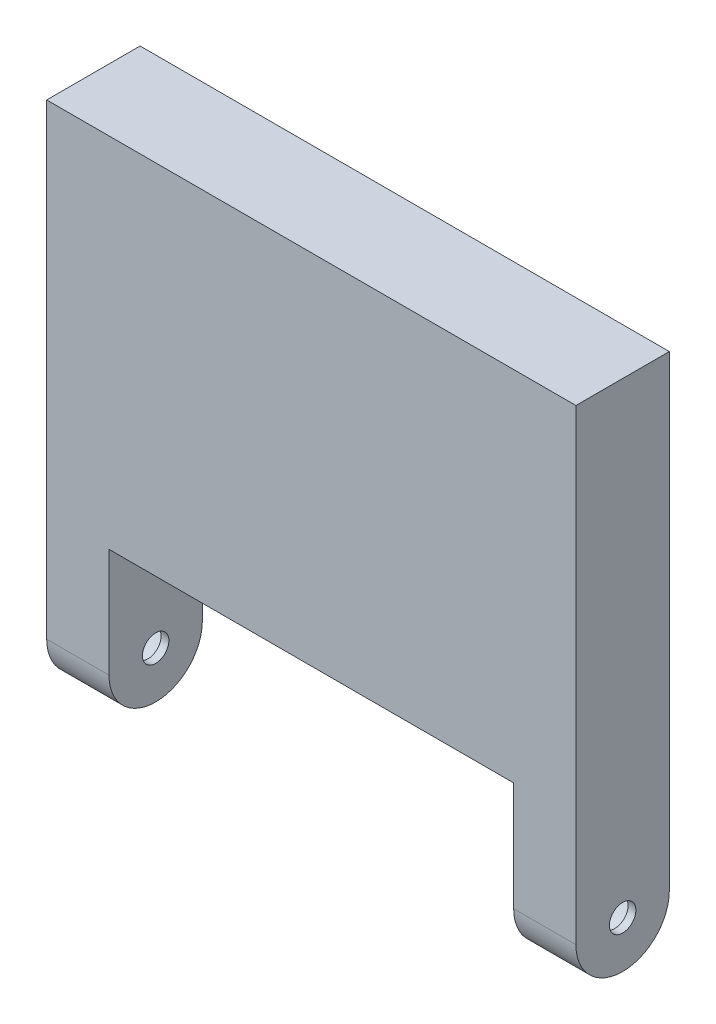
from build123d import *

# Parameters (mm, degrees)
BOSS_EXTRUDE1_START = -170
BOSS_EXTRUDE1_DEPTH = 5
BOSS_EXTRUDE2_START = -165
SKETCH3_4_W         = 5
SKETCH3_4_H         = 5
BOSS_EXTRUDE2_DEPTH = 30
BOSS_EXTRUDE3_START = -135
SKETCH3_5_W         = 50
SKETCH3_5_H         = 220
BOSS_EXTRUDE3_DEPTH = 5
BOSS_EXTRUDE4_START = -130
SKETCH3_6_W         = 5
SKETCH3_6_H         = 5
SKETCH3_6_W_2       = 50
BOSS_EXTRUDE4_DEPTH = 130
SKETCH6_R           = 8.5
CUT_EXTRUDE1_DEPTH  = 347.121365998


with BuildPart() as part:
    # Sketch3 → Boss-Extrude1 (new body)
    with BuildSketch(Plane(origin=(0, 0, 0), x_dir=(0, 0, -1), z_dir=(1, 0, 0)).offset(BOSS_EXTRUDE1_START)):
        with BuildLine():
            Line((-30, 0), (-30, 300))
            Line((-30, 300), (30, 300))
            Line((30, 300), (30, 0))
            ThreePointArc((30, 0), (0, -30), (-30, 0))
        make_face()
    extrude(amount=BOSS_EXTRUDE1_DEPTH)

    # Sketch3<4> → Boss-Extrude2 (add)
    with BuildSketch(Plane(origin=(0, 0, 0), x_dir=(0, 0, -1), z_dir=(1, 0, 0)).offset(BOSS_EXTRUDE2_START)):
        Polygon((-30, 75), (-25, 75), (-25, 295), (25, 295), (25, 75), (30, 75), (30, 300), (-30, 300), align=None)
        with Locations((-27.5, 72.5)):
            Rectangle(SKETCH3_4_W, SKETCH3_4_H)
        with BuildLine():
            Line((0, -30), (0, -25))
            ThreePointArc((0, -25), (-17.67766953, -17.67766953), (-25, 0))
            Line((-25, 0), (-25, 70))
            Line((-25, 70), (-30, 70))
            Line((-30, 70), (-30, 0))
            ThreePointArc((-30, 0), (-21.213203436, -21.213203436), (0, -30))
        make_face()
        with Locations((27.5, 72.5)):
            Rectangle(SKETCH3_4_W, SKETCH3_4_H)
        with BuildLine():
            ThreePointArc((25, 0), (17.67766953, -17.67766953), (0, -25))
            Line((0, -25), (0, -30))
            ThreePointArc((0, -30), (21.213203436, -21.213203436), (30, 0))
            Line((30, 0), (30, 70))
            Line((30, 70), (25, 70))
            Line((25, 70), (25, 0))
        make_face()
    extrude(amount=BOSS_EXTRUDE2_DEPTH)

    # Sketch3<5> → Boss-Extrude3 (add)
    with BuildSketch(Plane(origin=(0, 0, 0), x_dir=(0, 0, -1), z_dir=(1, 0, 0)).offset(BOSS_EXTRUDE3_START)):
        with BuildLine():
            ThreePointArc((-30, 0), (0, -30), (30, 0))
            Line((30, 0), (30, 300))
            Line((30, 300), (-30, 300))
            Line((-30, 300), (-30, 0))
        make_face()
        with Locations((0, 185)):
            Rectangle(SKETCH3_5_W, SKETCH3_5_H, mode=Mode.SUBTRACT)
    extrude(amount=BOSS_EXTRUDE3_DEPTH)

    # Sketch3<6> → Boss-Extrude4 (add)
    with BuildSketch(Plane(origin=(0, 0, 0), x_dir=(0, 0, -1), z_dir=(1, 0, 0)).offset(BOSS_EXTRUDE4_START)):
        Polygon((-30, 300), (-30, 75), (-25, 75), (-25, 295), (25, 295), (25, 75), (30, 75), (30, 300), align=None)
        with Locations((-27.5, 72.5)):
            Rectangle(SKETCH3_6_W, SKETCH3_6_H)
        with Locations((0, 72.5)):
            Rectangle(SKETCH3_6_W_2, SKETCH3_6_H)
        with Locations((27.5, 72.5)):
            Rectangle(SKETCH3_6_W, SKETCH3_6_H)
    extrude(amount=BOSS_EXTRUDE4_DEPTH)

    # Sketch6 → Cut-Extrude1 (cut, through all)
    with BuildSketch(Plane(origin=(0, 0, 0), x_dir=(0, 0, -1), z_dir=(1, 0, 0))):
        Circle(SKETCH6_R)
    extrude(amount=-CUT_EXTRUDE1_DEPTH, mode=Mode.SUBTRACT)

    # Mirror5: part across plane


with BuildPart() as part_1:
    add(part.part)
    add(part.part.mirror(Plane(origin=(0, 0, 0), x_dir=(0, 0, 1), z_dir=(1, 0, 0))))


solid = part_1.part
